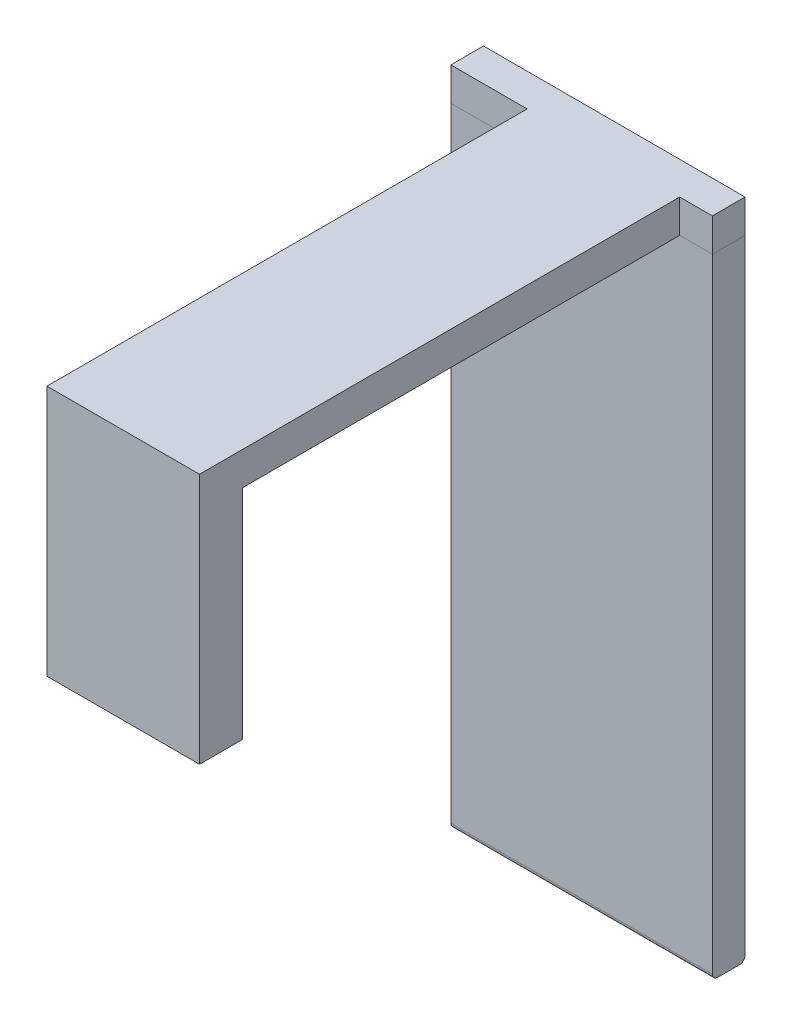
from build123d import *

# Parameters (mm, degrees)
EXTRUDE_1_DEPTH      = 57.7
EXTRUDE_2_DEPTH      = 40.1
EXTRUDE_2_DEPTH_BACK = 3
SKETCH_2_W           = 24
SKETCH_2_H           = 3.048049907
EXTRUDE_4_DEPTH      = 20
EXTRUDE_4_DEPTH_BACK = 3.04805
SKETCH_3_W           = 24
SKETCH_3_H           = 3.957309811
SKETCH_4_W           = 7
SKETCH_4_H           = 44.057309811
CUT_EXTRUDE_1_DEPTH  = 51
SKETCH_5_W           = 3
SKETCH_5_H           = 44.057309811
CUT_EXTRUDE_2_DEPTH  = 51
FILLET_1_R           = 0.5


with BuildPart() as part:
    # 草图1 → 凸台-拉伸1 (new body)
    with BuildSketch(Plane(origin=(0, 0, 0), x_dir=(1, 0, 0), z_dir=(0, 1, 0))):
        Polygon((3.532298037, 0), (0, 0), (0, -3), (24, -3), (24, 0), align=None)
    extrude(amount=EXTRUDE_1_DEPTH)

    # 圆角1
    fillet_1_edges = [part.edges().sort_by_distance(p)[0] for p in [
        (12, 0, 3),
        (12, 0, 0),
    ]]
    fillet(fillet_1_edges, radius=FILLET_1_R)


with BuildPart() as body_2:
    # 草图2 → 凸台-拉伸2 (new, two sides: drawn at the far end of the back side and taken through both)
    with BuildSketch(Plane.XY.offset(3).offset(-EXTRUDE_2_DEPTH_BACK)):
        with Locations((12, 59.224024954)):
            Rectangle(SKETCH_2_W, SKETCH_2_H)
    extrude(amount=EXTRUDE_2_DEPTH + EXTRUDE_2_DEPTH_BACK)

    # 草图3 → 凸台-拉伸4 (add, two sides: drawn at the far end of the back side and taken through both)
    with BuildSketch(Plane.XZ.offset(-57.7).offset(-EXTRUDE_4_DEPTH_BACK)):
        with Locations((12, 45.078654906)):
            Rectangle(SKETCH_3_W, SKETCH_3_H)
    extrude(amount=EXTRUDE_4_DEPTH + EXTRUDE_4_DEPTH_BACK)

    # 草图4 → 切除-拉伸1 (cut)
    with BuildSketch(Plane.XZ.offset(-37.7)):
        with Locations((3.5, 25.028654906)):
            Rectangle(SKETCH_4_W, SKETCH_4_H)
    extrude(amount=-CUT_EXTRUDE_1_DEPTH, mode=Mode.SUBTRACT)

    # 草图5 → 切除-拉伸2 (cut)
    with BuildSketch(Plane.XZ.offset(-37.7)):
        with Locations((22.5, 25.028654906)):
            Rectangle(SKETCH_5_W, SKETCH_5_H)
    extrude(amount=-CUT_EXTRUDE_2_DEPTH, mode=Mode.SUBTRACT)


solid = Compound([part.part, body_2.part])
